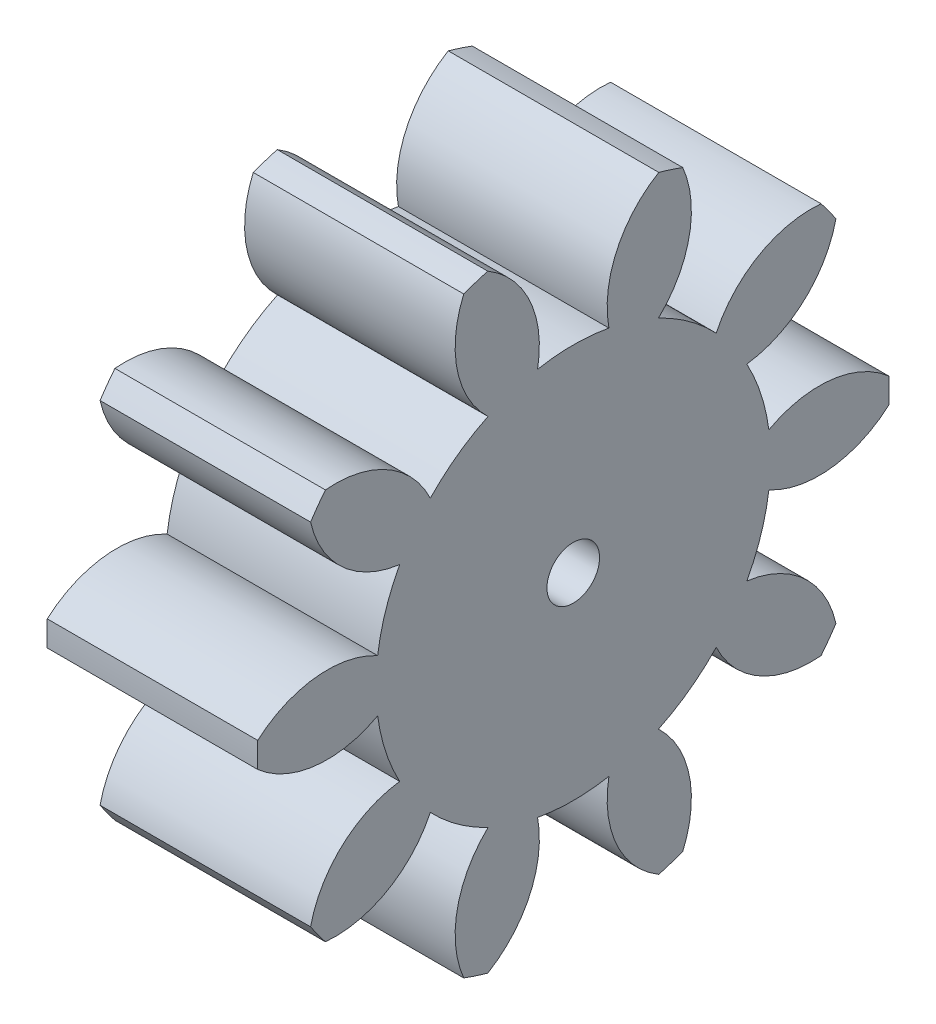
from build123d import *

# Parameters (mm, degrees)
BASPROSKE_W     = 12
BASPROSKE_H     = 18
TOOTHCUT_DEPTH  = 29.142494559
TEETHCUTS_COUNT = 10
TEETHCUTS_ANGLE = 324
BORSKE_R        = 1.5
BORE_DEPTH      = 50.0000508


with BuildPart() as part:
    # BasProSke → Base-Revolve (revolve)
    with BuildSketch(Plane(origin=(0, 0, 0), x_dir=(1, 0, 0), z_dir=(0, 1, 0)), mode=Mode.PRIVATE) as base_revolve_sk:
        with Locations((6, 9)):
            Rectangle(BASPROSKE_W, BASPROSKE_H)
    revolve(base_revolve_sk.sketch.rotate(Axis((-10, 0, 0), (1, 0, 0)), 180), axis=Axis((-10, 0, 0), (1, 0, 0)))

    # TooCutSke → ToothCut (cut, through all)
    with BuildSketch(Plane(origin=(0, 0, 0), x_dir=(0, 0, -1), z_dir=(1, 0, 0))):
        with BuildLine():
            ThreePointArc((2.033323271, 11.063706317), (0, 11.249), (-2.033323271, 11.063706317))
            ThreePointArc((-2.033323271, 11.063706317), (-2.474297893, 14.659068577), (-4.904241297, 17.34541618))
            ThreePointArc((-4.904241297, 17.34541618), (0, 18.0254), (4.904241297, 17.34541618))
            ThreePointArc((4.904241297, 17.34541618), (2.474297893, 14.659068577), (2.033323271, 11.063706317))
        make_face()
    toothcut = extrude(amount=TOOTHCUT_DEPTH, mode=Mode.SUBTRACT)

    # TeethCuts: ToothCut ×10 about axis
    teethcuts_axis = Axis((-10, 0, 0), (1, 0, 0))
    for i in range(1, TEETHCUTS_COUNT):
        add(toothcut.rotate(teethcuts_axis, i * TEETHCUTS_ANGLE / (TEETHCUTS_COUNT - 1)), mode=Mode.SUBTRACT)

    # BorSke → Bore (cut, symmetric)
    with BuildSketch(Plane(origin=(0, 0, 0), x_dir=(0, 0, -1), z_dir=(1, 0, 0))):
        with Locations(Location((0, 0, 0), (0, 0, 180))):
            Circle(BORSKE_R)
    extrude(amount=BORE_DEPTH, both=True, mode=Mode.SUBTRACT)


solid = part.part
